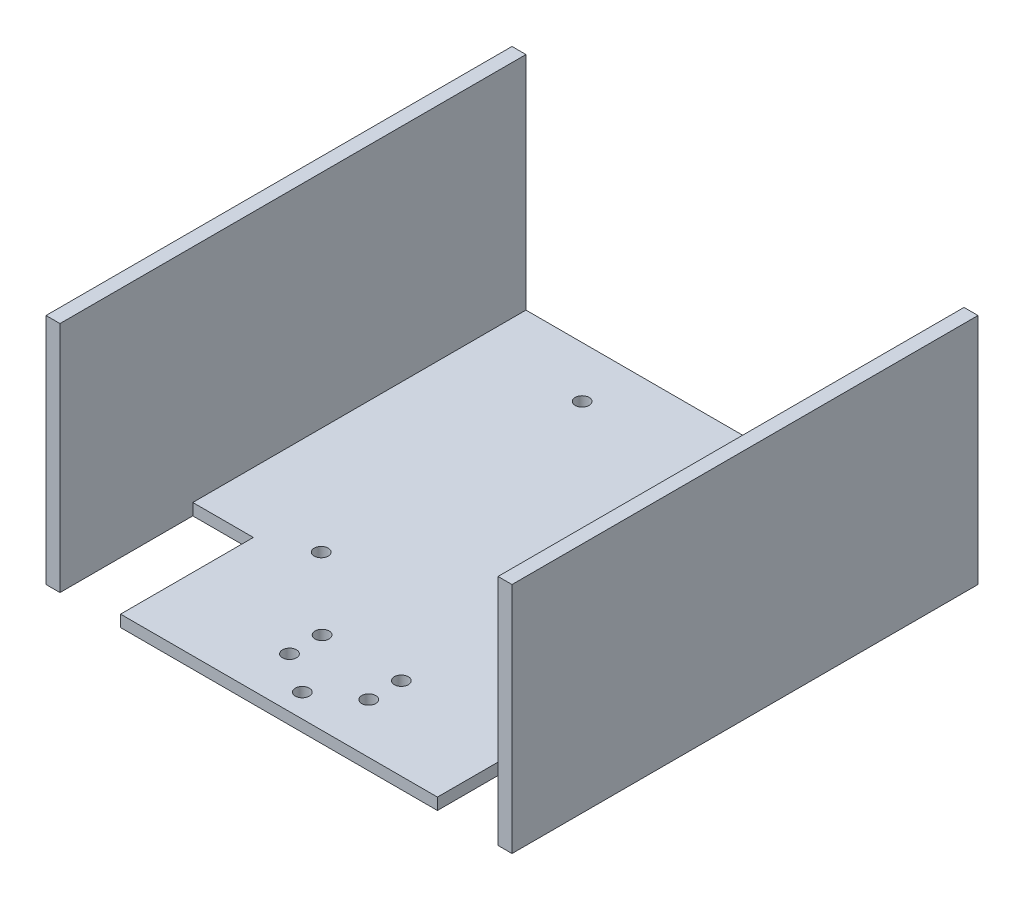
from build123d import *

# Parameters (mm, degrees)
SALIENTE_EXTRUIR1_DEPTH = 100
CROQUIS2_W              = 13
CROQUIS2_H              = 28.5
CORTAR_EXTRUIR2_DEPTH   = 10
CROQUIS3_R              = 1.5
CORTAR_EXTRUIR3_DEPTH   = 5
CROQUIS4_R              = 1.5
CORTAR_EXTRUIR4_DEPTH   = 10
CROQUIS5_R              = 1.5
CORTAR_EXTRUIR6_DEPTH   = 10


with BuildPart() as part:
    # Croquis1 → Saliente-Extruir1 (new body)
    with BuildSketch(Plane.XY):
        Polygon((50, 0), (-50, 0), (-50, 50), (-47, 50), (-47, 2.5), (47, 2.5), (47, 50), (50, 50), align=None)
    extrude(amount=-SALIENTE_EXTRUIR1_DEPTH)

    # Croquis2 → Cortar-Extruir2 (cut)
    with BuildSketch(Plane(origin=(0, 2.5, 0), x_dir=(1, 0, 0), z_dir=(0, 1, 0))):
        with Locations((-40.5, 14.25)):
            Rectangle(CROQUIS2_W, CROQUIS2_H)
        with Locations((40.5, 14.25)):
            Rectangle(CROQUIS2_W, CROQUIS2_H)
    extrude(amount=-CORTAR_EXTRUIR2_DEPTH, mode=Mode.SUBTRACT)

    # Croquis3 → Cortar-Extruir3 (cut)
    with BuildSketch(Plane(origin=(0, 2.5, 0), x_dir=(1, 0, 0), z_dir=(0, 1, 0))):
        with Locations(Location((0, 5, 0), (0, 0, 270))):
            Circle(CROQUIS3_R)
    extrude(amount=-CORTAR_EXTRUIR3_DEPTH, mode=Mode.SUBTRACT)

    # Croquis4 → Cortar-Extruir4 (cut)
    with BuildSketch(Plane(origin=(0, 2.5, 0), x_dir=(1, 0, 0), z_dir=(0, 1, 0))):
        with Locations(Location((-8.5, 17.75, 0), (0, 0, 270))):
            Circle(CROQUIS4_R)
        with Locations(Location((-8.5, 10.75, 0), (0, 0, 270))):
            Circle(CROQUIS4_R)
        with Locations(Location((8.5, 10.75, 0), (0, 0, 180))):
            Circle(CROQUIS4_R)
        with Locations(Location((8.5, 17.75, 0), (0, 0, 180))):
            Circle(CROQUIS4_R)
    extrude(amount=-CORTAR_EXTRUIR4_DEPTH, mode=Mode.SUBTRACT)

    # Croquis5 → Cortar-Extruir6 (cut)
    with BuildSketch(Plane(origin=(0, 2.5, 0), x_dir=(1, 0, 0), z_dir=(0, 1, 0))):
        with Locations(Location((-24, 89.05, 0), (0, 0, 270))):
            Circle(CROQUIS5_R)
        with Locations(Location((-24, 33.05, 0), (0, 0, 270))):
            Circle(CROQUIS5_R)
        with Locations(Location((24, 33.05, 0), (0, 0, 180))):
            Circle(CROQUIS5_R)
        with Locations(Location((24, 89.05, 0), (0, 0, 180))):
            Circle(CROQUIS5_R)
    extrude(amount=-CORTAR_EXTRUIR6_DEPTH, mode=Mode.SUBTRACT)


solid = part.part
